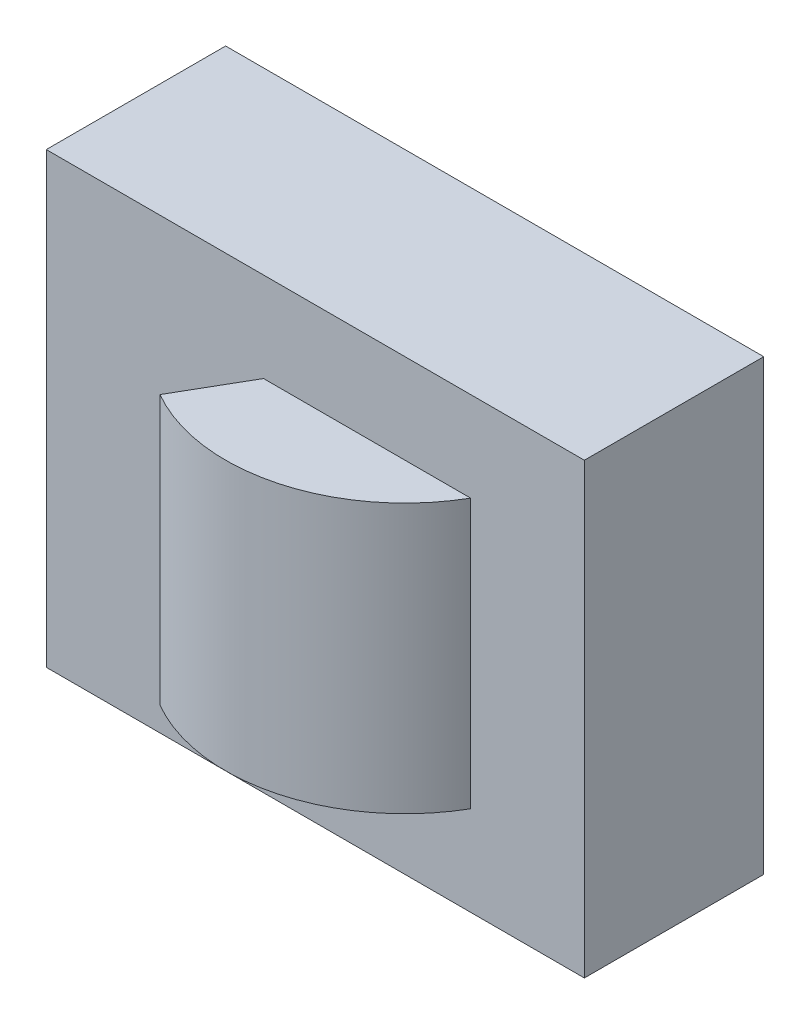
from build123d import *

# Parameters (mm, degrees)
SKETCH1_W           = 60
SKETCH1_H           = 50
BOSS_EXTRUDE1_DEPTH = 10
SKETCH2_W           = 15
SKETCH2_H           = 30
REVOLVE1_ANGLE      = 120


with BuildPart() as part:
    # Sketch1 → Boss-Extrude1 (new, symmetric)
    with BuildSketch(Plane.XY):
        with Locations((0, 15)):
            Rectangle(SKETCH1_W, SKETCH1_H)
    extrude(amount=BOSS_EXTRUDE1_DEPTH, both=True)

    # Sketch2 → Revolve1 (revolve)
    with BuildSketch(Plane.XY):
        with Locations((12.5, 15)):
            Rectangle(SKETCH2_W, SKETCH2_H)
    revolve(axis=Axis((0, 0, 0), (0, -1, 0)), revolution_arc=REVOLVE1_ANGLE)


solid = part.part
